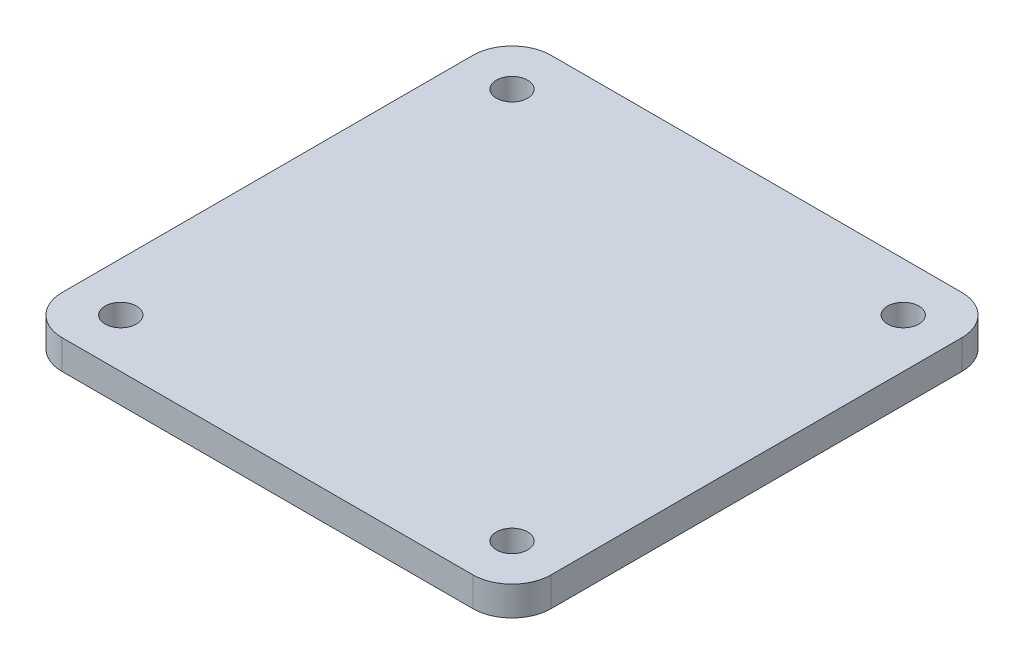
from build123d import *

# Parameters (mm, degrees)
SKETCH1_W           = 50
SKETCH1_H           = 50
BOSS_EXTRUDE1_DEPTH = 3
SKETCH2_R           = 1.6
CUT_EXTRUDE1_DEPTH  = 3
FILLET1_R           = 4


with BuildPart() as part:
    # Sketch1 → Boss-Extrude1 (new body)
    with BuildSketch(Plane(origin=(0, 0, 0), x_dir=(1, 0, 0), z_dir=(0, 1, 0))):
        Rectangle(SKETCH1_W, SKETCH1_H)
    extrude(amount=BOSS_EXTRUDE1_DEPTH)

    # Sketch2 → Cut-Extrude1 (cut)
    with BuildSketch(Plane(origin=(0, 3, 0), x_dir=(1, 0, 0), z_dir=(0, 1, 0))):
        with Locations(Location((-20, 20, 0), (0, 0, 270))):
            Circle(SKETCH2_R)
        with Locations(Location((20, 20, 0), (0, 0, 270))):
            Circle(SKETCH2_R)
        with Locations(Location((20, -20, 0), (0, 0, 270))):
            Circle(SKETCH2_R)
        with Locations(Location((-20, -20, 0), (0, 0, 270))):
            Circle(SKETCH2_R)
    extrude(amount=-CUT_EXTRUDE1_DEPTH, mode=Mode.SUBTRACT)

    # Fillet1
    fillet1_edges = [part.edges().sort_by_distance(p)[0] for p in [
        (25, 1.5, 25),
        (-25, 1.5, 25),
        (-25, 1.5, -25),
        (25, 1.5, -25),
    ]]
    fillet(fillet1_edges, radius=FILLET1_R)


solid = part.part
